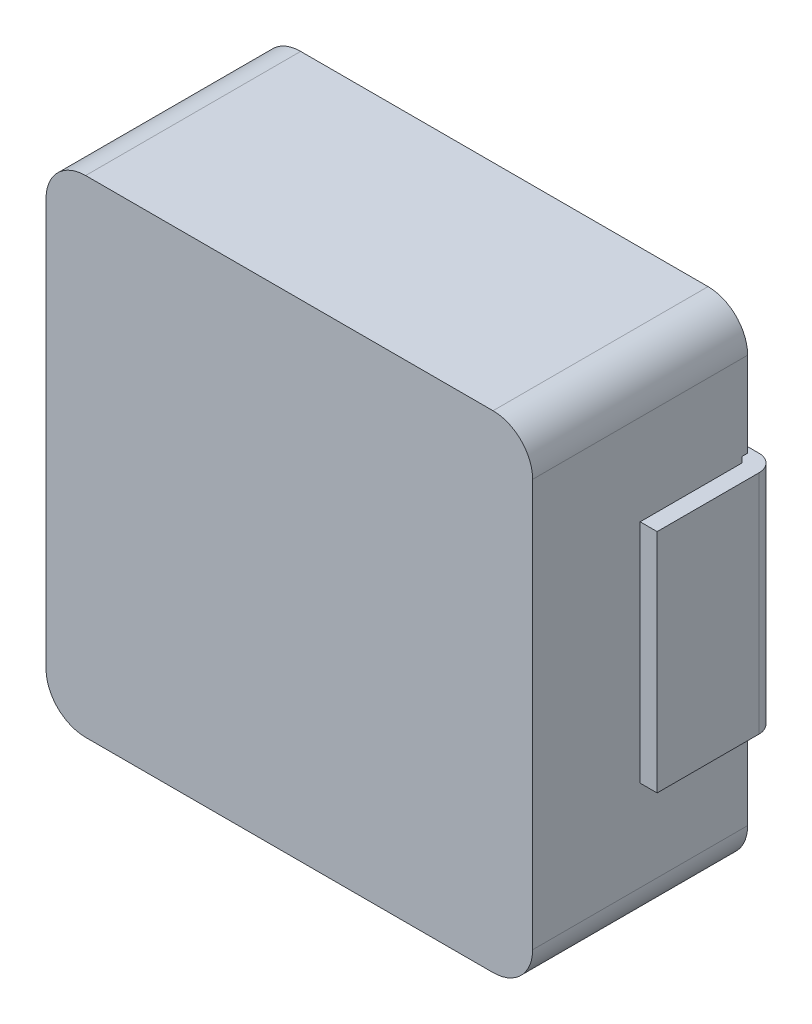
from build123d import *

# Parameters (mm, degrees)
SKETCH1_W           = 4.3
SKETCH1_H           = 4.3
BOSS_EXTRUDE1_DEPTH = 1.9
FILLET1_R           = 0.35
SKETCH2_W           = 0.9
SKETCH2_H           = 2.1
CUT_EXTRUDE1_DEPTH  = 0.05
SKETCH3_W           = 1
SKETCH3_H           = 2
BOSS_EXTRUDE2_DEPTH = 0.15
SKETCH4_W           = 0.15
SKETCH4_H           = 2
BOSS_EXTRUDE3_DEPTH = 0.9
FILLET2_R           = 0.15


with BuildPart() as part:
    # Sketch1 → Boss-Extrude1 (new body)
    with BuildSketch(Plane.XY):
        Rectangle(SKETCH1_W, SKETCH1_H)
    extrude(amount=BOSS_EXTRUDE1_DEPTH)

    # Fillet1
    fillet1_edges = [part.edges().sort_by_distance(p)[0] for p in [
        (2.15, -2.15, 0.95),
        (-2.15, -2.15, 0.95),
        (-2.15, 2.15, 0.95),
        (2.15, 2.15, 0.95),
    ]]
    fillet(fillet1_edges, radius=FILLET1_R)

    # Sketch2 → Cut-Extrude1 (cut)
    with BuildSketch(Plane(origin=(0, 0, 0), x_dir=(-1, 0, 0), z_dir=(0, 0, -1))):
        with Locations((1.7, 0)):
            Rectangle(SKETCH2_W, SKETCH2_H)
        with Locations((-1.7, 0)):
            Rectangle(SKETCH2_W, SKETCH2_H)
    extrude(amount=-CUT_EXTRUDE1_DEPTH, mode=Mode.SUBTRACT)

    # Sketch3 → Boss-Extrude2 (add)
    with BuildSketch(Plane(origin=(0, 0, 0.05), x_dir=(-1, 0, 0), z_dir=(0, 0, -1))):
        with Locations((1.8, 0)):
            Rectangle(SKETCH3_W, SKETCH3_H)
        with Locations((-1.8, 0)):
            Rectangle(SKETCH3_W, SKETCH3_H)
    extrude(amount=BOSS_EXTRUDE2_DEPTH)

    # Sketch4 → Boss-Extrude3 (add)
    with BuildSketch(Plane.XY.offset(0.05)):
        with Locations((-2.225, 0)):
            Rectangle(SKETCH4_W, SKETCH4_H)
        with Locations((2.225, 0)):
            Rectangle(SKETCH4_W, SKETCH4_H)
    extrude(amount=BOSS_EXTRUDE3_DEPTH)

    # Fillet2
    fillet2_edges = [part.edges().sort_by_distance(p)[0] for p in [
        (-2.3, 0, -0.1),
        (2.3, 0, -0.1),
    ]]
    fillet(fillet2_edges, radius=FILLET2_R)


solid = part.part
